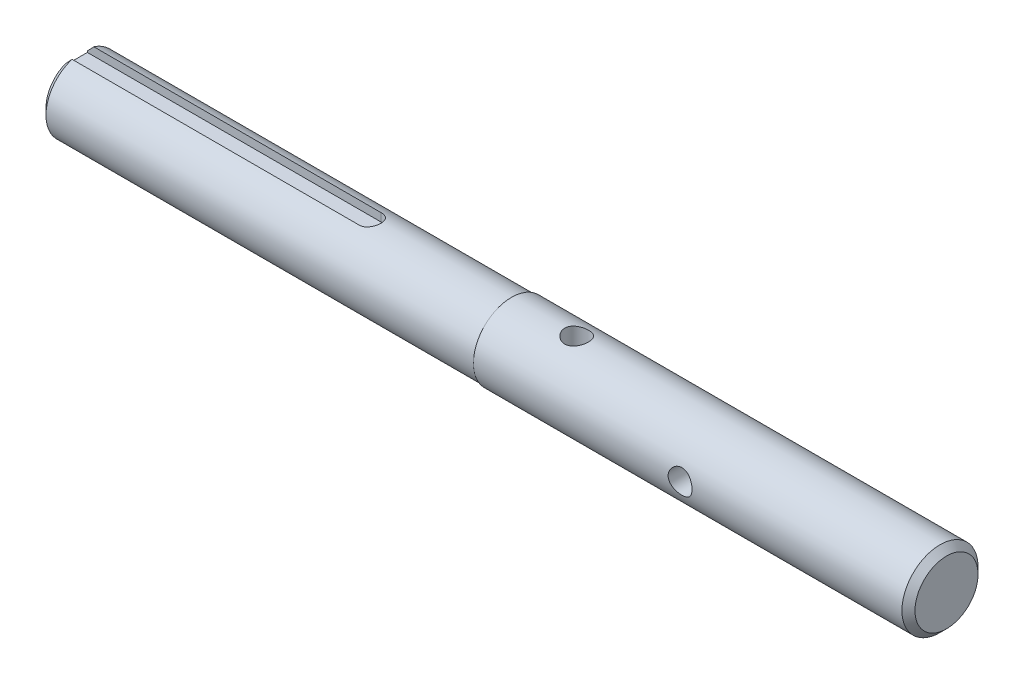
from build123d import *

# Parameters (mm, degrees)
CHAMFER1_SIZE           = 3
CUT_EXTRUDE1_START      = 17
CUT_EXTRUDE1_DEPTH      = 4.5
CUT_EXTRUDE2_DEPTH      = 401.764893672
CUT_EXTRUDE2_DEPTH_BACK = 401.764893672
SKETCH3_R               = 5.5
CUT_EXTRUDE3_DEPTH      = 401.764893681
CUT_EXTRUDE3_DEPTH_BACK = 401.764893681
SKETCH4_R               = 5.5


with BuildPart() as part:
    # Sketch1 → Revolve1 (revolve)
    with BuildSketch(Plane.XY, mode=Mode.PRIVATE) as revolve1_sk:
        Polygon((0, 0), (400, 0), (400, 17.5), (200, 17.5), (200, 17), (0, 17), align=None)
    revolve(revolve1_sk.sketch.rotate(Axis((0, 0, 0), (1, 0, 0)), 90), axis=Axis((0, 0, 0), (1, 0, 0)))

    # Chamfer1
    chamfer1_edges = [part.edges().sort_by_distance(p)[0] for p in [
        (0, 0, -17),
        (400, 0, -17.5),
    ]]
    chamfer(chamfer1_edges, length=CHAMFER1_SIZE)

    # Sketch2 → Cut-Extrude1 (cut)
    with BuildSketch(Plane(origin=(0, 0, 0), x_dir=(1, 0, 0), z_dir=(0, 1, 0)).offset(CUT_EXTRUDE1_START)):
        with BuildLine():
            Line((0, 5), (135, 5))
            ThreePointArc((135, 5), (140, 0), (135, -5))
            Line((135, -5), (0, -5))
            Line((0, -5), (0, 5))
        make_face()
    extrude(amount=-CUT_EXTRUDE1_DEPTH, mode=Mode.SUBTRACT)

    # Sketch3 → Cut-Extrude2 (cut, two sides: drawn at the far end of the back side and taken through both)
    with BuildSketch(Plane(origin=(0, 0, 0), x_dir=(1, 0, 0), z_dir=(0, 1, 0)).offset(-CUT_EXTRUDE2_DEPTH_BACK)):
        with Locations(Location((230, 0, 0), (0, 0, 270))):
            Circle(SKETCH3_R)
    extrude(amount=CUT_EXTRUDE2_DEPTH + CUT_EXTRUDE2_DEPTH_BACK, mode=Mode.SUBTRACT)

    # Sketch4 → Cut-Extrude3 (cut, two sides: drawn at the far end of the back side and taken through both)
    with BuildSketch(Plane.XY.offset(-CUT_EXTRUDE3_DEPTH_BACK)):
        with Locations((295, 0)):
            Circle(SKETCH4_R)
    extrude(amount=CUT_EXTRUDE3_DEPTH + CUT_EXTRUDE3_DEPTH_BACK, mode=Mode.SUBTRACT)


solid = part.part
